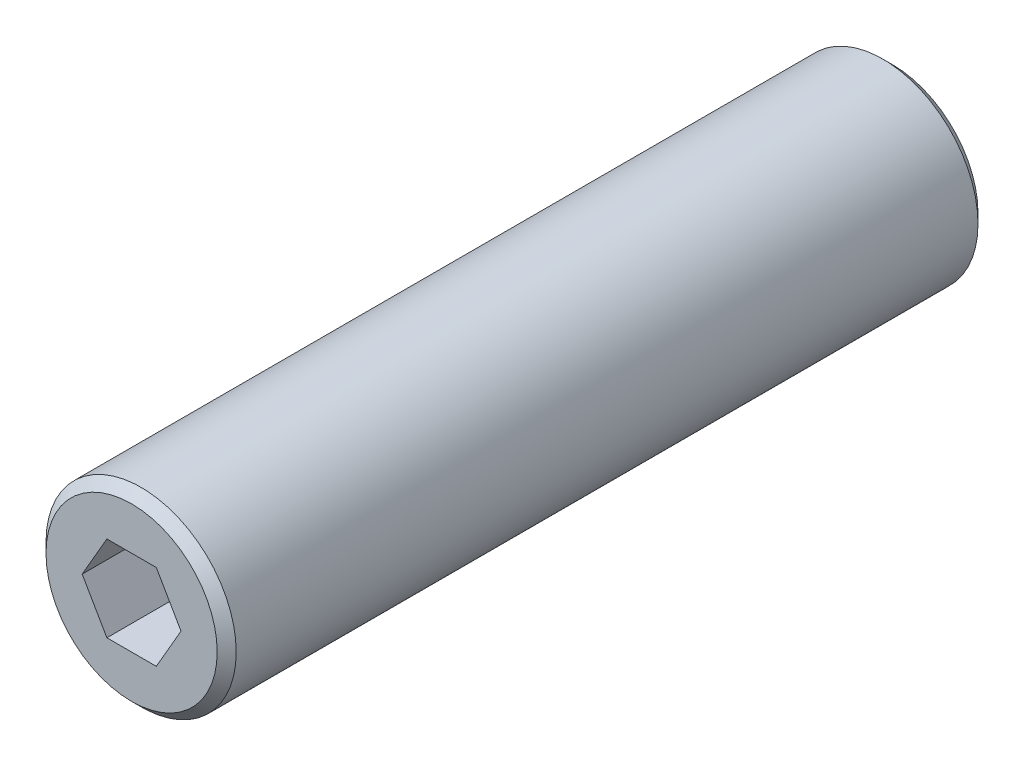
from build123d import *

# Parameters (mm, degrees)
SKETCH_1_R          = 1
EXTRUDE_1_DEPTH     = 4
CUT_EXTRUDE_1_DEPTH = 0.8
CHAMFER_1_SIZE      = 0.1


with BuildPart() as part:
    # 草图1 → 凸台-拉伸1 (new, symmetric)
    with BuildSketch(Plane.XY):
        Circle(SKETCH_1_R)
    extrude(amount=EXTRUDE_1_DEPTH, both=True)

    # 草图2 → 切除-拉伸1 (cut)
    with BuildSketch(Plane.XY.offset(4)):
        Polygon((0.259807621, 0.45), (-0.259807621, 0.45), (-0.519615242, 0), (-0.259807621, -0.45), (0.259807621, -0.45), (0.519615242, 0), align=None)
    extrude(amount=-CUT_EXTRUDE_1_DEPTH, mode=Mode.SUBTRACT)

    # 倒角1
    chamfer_1_edges = [part.edges().sort_by_distance(p)[0] for p in [
        (-1, 0, -4),
        (-1, 0, 4),
    ]]
    chamfer(chamfer_1_edges, length=CHAMFER_1_SIZE)


solid = part.part
